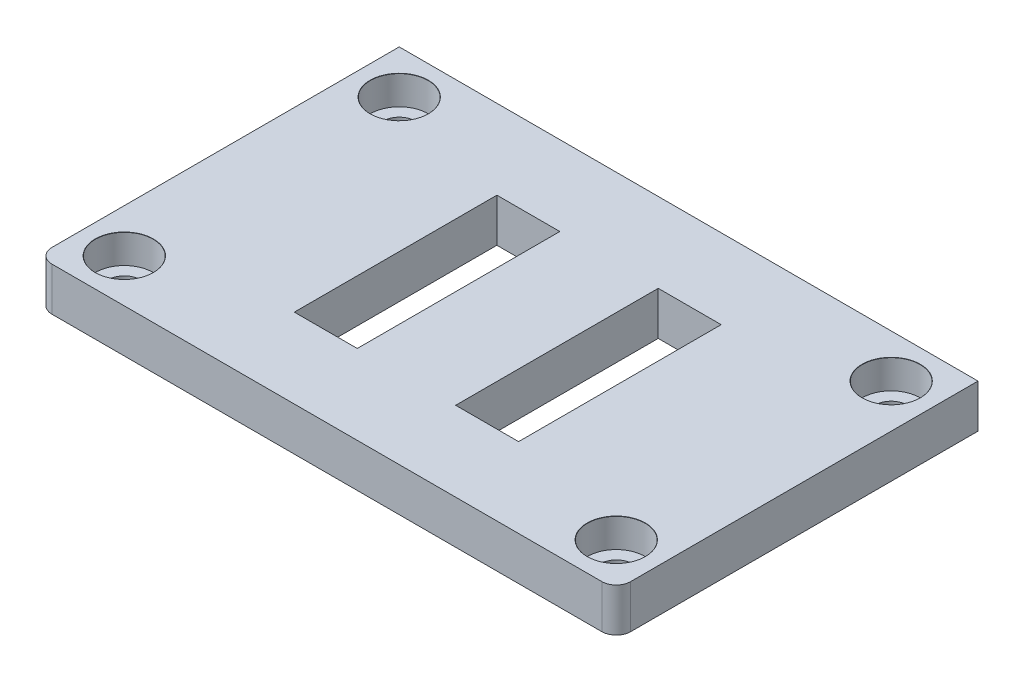
from build123d import *

# Parameters (mm, degrees)
SKETCH2_W                     = 40
SKETCH2_H                     = 50
SKETCH2_W_2                   = 8.7
SKETCH2_H_2                   = 28
BOSS_EXTRUDE1_DEPTH           = 6
CBORE_FOR_M4_SHCS2_AT_2_COUNT = 2
CBORE_FOR_M4_SHCS2_AT_2_PITCH = 38
FILLET1_R                     = 2


with BuildPart() as part:
    # Sketch2 → Boss-Extrude1 (new body)
    with BuildSketch(Plane(origin=(0, 0, 0), x_dir=(1, 0, 0), z_dir=(0, 1, 0))):
        Rectangle(SKETCH2_W, SKETCH2_H)
        with Locations((8.85, 0)):
            Rectangle(SKETCH2_W_2, SKETCH2_H_2, mode=Mode.SUBTRACT)
    boss_extrude1 = extrude(amount=BOSS_EXTRUDE1_DEPTH)

    # Sketch4 → CBORE for M4 SHCS2 (revolve, cut)
    with BuildSketch(Plane(origin=(-14, 6, 19), x_dir=(0, 0, 1), z_dir=(1, 0, 0))):
        Polygon((0, 0), (0, 6), (2.25, 6), (2.25, 4), (4, 4), (4, 0.025), (4.025, 0), align=None)
    cbore_for_m4_shcs2 = revolve(axis=Axis((-14, 12.35, 19), (0, -1, 0)), mode=Mode.SUBTRACT)

    # CBORE for M4 SHCS2 at 2: CBORE for M4 SHCS2 ×2
    with Locations(*[(0, 0, -i * CBORE_FOR_M4_SHCS2_AT_2_PITCH) for i in range(1, CBORE_FOR_M4_SHCS2_AT_2_COUNT)]):
        add(cbore_for_m4_shcs2, mode=Mode.SUBTRACT)

    # Mirror1: Boss-Extrude1, CBORE for M4 SHCS2 across plane
    add(boss_extrude1.mirror(Plane(origin=(20, 0, 0), x_dir=(0, 0, 1), z_dir=(1, 0, 0))))
    add(cbore_for_m4_shcs2.mirror(Plane(origin=(20, 0, 0), x_dir=(0, 0, 1), z_dir=(1, 0, 0))), mode=Mode.SUBTRACT)

    # Mirror1 copy 1 sketch → Mirror1 copy 1 (revolve, cut)
    with BuildSketch(Plane(origin=(54, 6, -19), x_dir=(0, 0, 1), z_dir=(-1, 0, 0))):
        Polygon((0, 0), (0, -6), (2.25, -6), (2.25, -4), (4, -4), (4, -0.025), (4.025, 0), align=None)
    revolve(axis=Axis((54, 12.35, -19), (0, 1, 0)), mode=Mode.SUBTRACT)

    # Fillet1
    fillet1_edges = [part.edges().sort_by_distance(p)[0] for p in [
        (60, 3, 25),
        (-20, 3, 25),
    ]]
    fillet(fillet1_edges, radius=FILLET1_R)


solid = part.part
